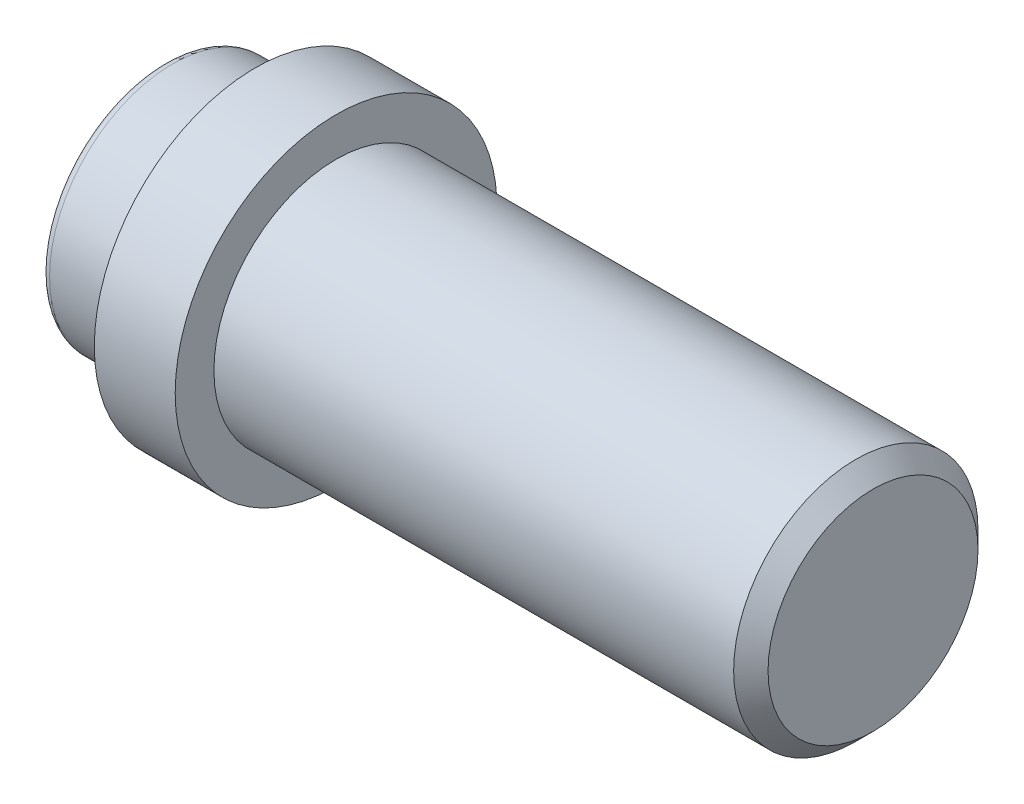
from build123d import *

# Parameters (mm, degrees)
HOLE1_D           = 2.7178
HOLE1_DEPTH       = 8.636
HOLE1_CSINK_D     = 2.9972
HOLE1_CSINK_ANGLE = 60
HOLE1_TIP         = 0.816509495


with BuildPart() as part:
    # Sketch1 → RevolutionAngle1 (revolve)
    with BuildSketch(Plane.XY):
        with BuildLine():
            Line((0.127, 1.8161), (1.3462, 1.8161))
            Line((1.3462, 1.8161), (1.3462, 2.3749))
            Line((1.3462, 2.3749), (2.54, 2.3749))
            Line((2.54, 2.3749), (2.54, 1.8034))
            Line((2.54, 1.8034), (10.2108, 1.8034))
            Line((10.2108, 1.8034), (10.4648, 1.5494))
            Line((10.4648, 1.5494), (10.4648, 0))
            Line((10.4648, 0), (0, 0))
            Line((0, 0), (0, 1.6891))
            ThreePointArc((0, 1.6891), (0.037197439, 1.778902561), (0.127, 1.8161))
        make_face()
    revolve(axis=Axis((0, 0, 0), (1, 0, 0)))

    # Hole1
    with Locations(Plane.ZY):
        with Locations((0, 0)):
            CounterSinkHole(HOLE1_D / 2, HOLE1_CSINK_D / 2, depth=HOLE1_DEPTH, counter_sink_angle=HOLE1_CSINK_ANGLE)
            with Locations((0, 0, -(HOLE1_DEPTH + HOLE1_TIP / 2))):  # 118° drill point
                Cone(0, HOLE1_D / 2, HOLE1_TIP, mode=Mode.SUBTRACT)


solid = part.part
